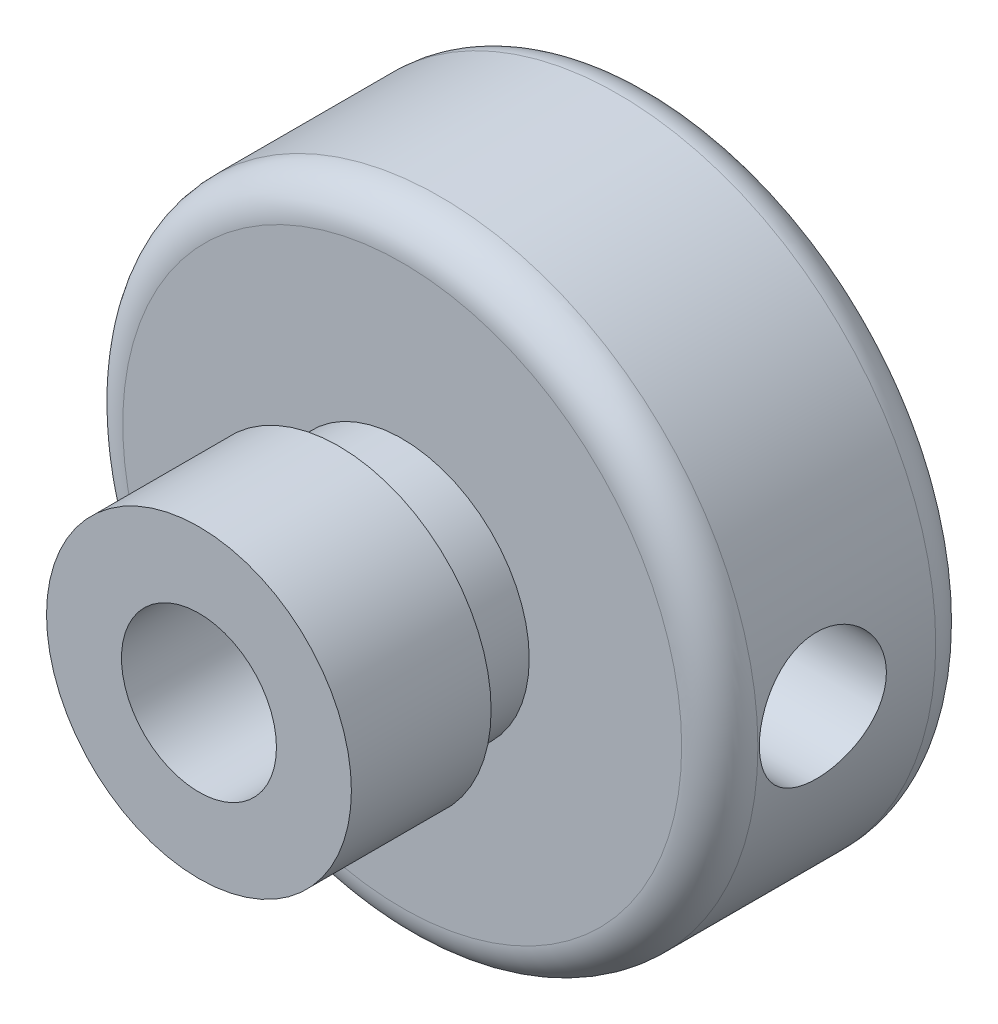
from build123d import *

# Parameters (mm, degrees)
ESQUISSE1_R             = 12.5
BASE_EXTRUSION_DEPTH    = 10
ESQUISSE2_R             = 6
BOSS_EXTRU_1_DEPTH      = 8
ESQUISSE3_R             = 3.05
ENL_V_MAT_EXTRU_1_DEPTH = 26.228951623
ESQUISSE4_R             = 5
ENL_V_MAT_EXTRU_2_DEPTH = 8
ESQUISSE5_W             = 2.5
ESQUISSE5_H             = 2
CONG_1_R                = 1.5
ESQUISSE7_R             = 2.5
ENL_V_MAT_EXTRU_4_DEPTH = 8


with BuildPart() as part:
    # Esquisse1 → Base-Extrusion (new body)
    with BuildSketch(Plane.XY):
        Circle(ESQUISSE1_R)
    extrude(amount=BASE_EXTRUSION_DEPTH)

    # Esquisse2 → Boss.-Extru.1 (add)
    with BuildSketch(Plane.XY.offset(10)):
        Circle(ESQUISSE2_R)
    extrude(amount=BOSS_EXTRU_1_DEPTH)

    # Esquisse3 → Enlèv. mat.-Extru.1 (cut, through all)
    with BuildSketch(Plane.XY.offset(18)):
        Circle(ESQUISSE3_R)
    extrude(amount=-ENL_V_MAT_EXTRU_1_DEPTH, mode=Mode.SUBTRACT)

    # Esquisse4 → Enlèv. mat.-Extru.2 (cut)
    with BuildSketch(Plane(origin=(0, 0, 0), x_dir=(-1, 0, 0), z_dir=(0, 0, -1))):
        Circle(ESQUISSE4_R)
    extrude(amount=-ENL_V_MAT_EXTRU_2_DEPTH, mode=Mode.SUBTRACT)

    # Esquisse5 → Enlever de la matière-Révolution1 (revolve, cut)
    with BuildSketch(Plane(origin=(0, 0, 0), x_dir=(0, 0, -1), z_dir=(1, 0, 0)), mode=Mode.PRIVATE) as enlever_de_la_mati_re_r_volution1_sk:
        with Locations((-11.25, 6)):
            Rectangle(ESQUISSE5_W, ESQUISSE5_H)
    revolve(enlever_de_la_mati_re_r_volution1_sk.sketch.rotate(Axis((0, 0, 21.399826727), (0, 0, -1)), 90), axis=Axis((0, 0, 21.399826727), (0, 0, -1)), mode=Mode.SUBTRACT)

    # Congé1
    cong_1_edges = [part.edges().sort_by_distance(p)[0] for p in [
        (-12.5, 0, 0),
        (-12.5, 0, 10),
    ]]
    fillet(cong_1_edges, radius=CONG_1_R)

    # Esquisse7 → Enlèv. mat.-Extru.4 (cut)
    with BuildSketch(Plane(origin=(12.5, 0, 0), x_dir=(0, 0, -1), z_dir=(1, 0, 0))):
        with Locations((-5.942386831, 0)):
            Circle(ESQUISSE7_R)
    extrude(amount=-ENL_V_MAT_EXTRU_4_DEPTH, mode=Mode.SUBTRACT)


solid = part.part
